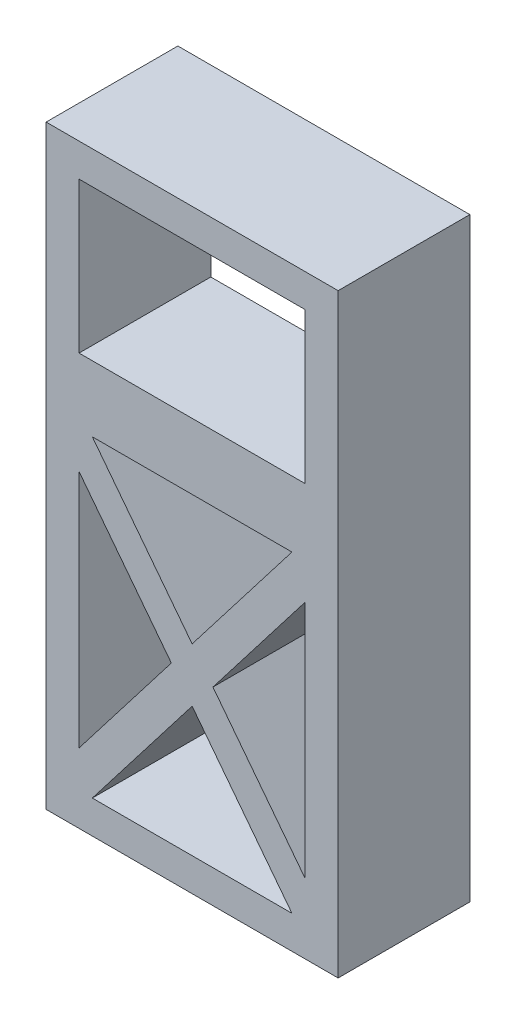
from build123d import *

# Parameters (mm, degrees)
SKETCH1_W           = 43.599999922
SKETCH1_H           = 29.050000066
BOSS_EXTRUDE1_DEPTH = 25.4


with BuildPart() as part:
    # Sketch1 → Boss-Extrude1 (new body)
    with BuildSketch(Plane.XY):
        Polygon((-28.149999961, -20.875000033), (-28.149999961, 20.875000033), (28.149999961, 20.875000033), (28.149999961, -20.875000033), (28.149999961, -93.900000033), (-28.149999961, -93.900000033), align=None)
        Rectangle(SKETCH1_W, SKETCH1_H, mode=Mode.SUBTRACT)
        Polygon((-19.245298339, -27.225000033), (0, -52.187485168), (19.245298339, -27.225000033), align=None, mode=Mode.SUBTRACT)
        Polygon((21.799999961, -34.311404785), (4.009049455, -57.387500033), (21.799999961, -80.463595281), align=None, mode=Mode.SUBTRACT)
        Polygon((-4.009049455, -57.387500033), (-21.799999961, -80.463595281), (-21.799999961, -34.311404785), align=None, mode=Mode.SUBTRACT)
        Polygon((0, -62.587514898), (-19.245298339, -87.550000033), (19.245298339, -87.550000033), align=None, mode=Mode.SUBTRACT)
    extrude(amount=BOSS_EXTRUDE1_DEPTH)


solid = part.part
